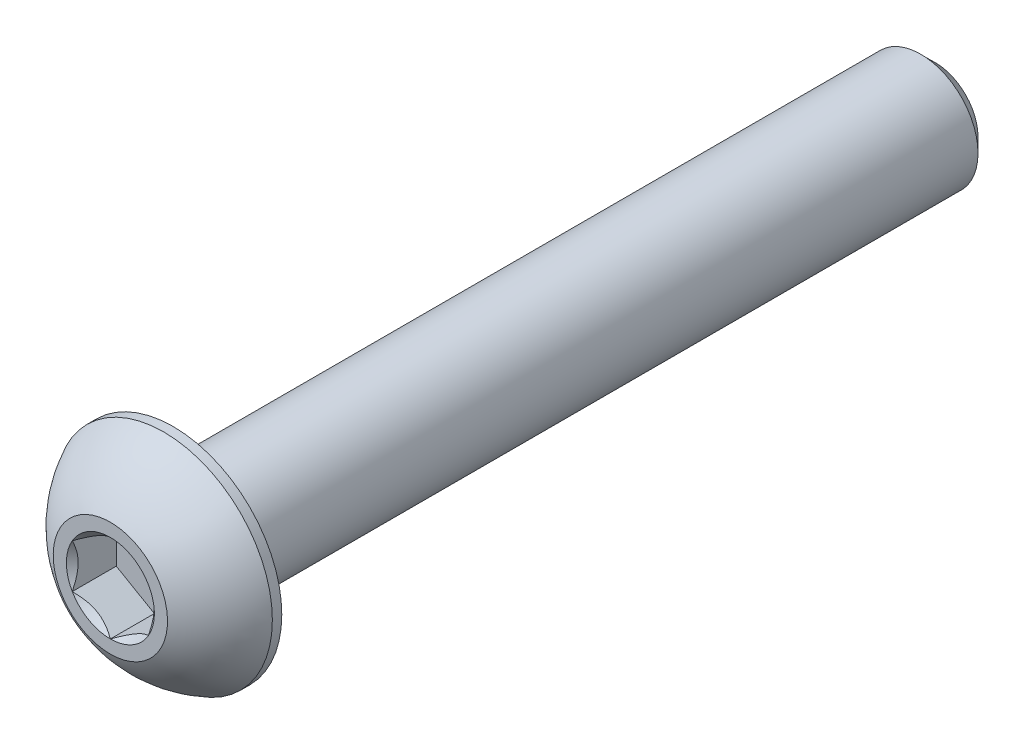
from build123d import *

# Parameters (mm, degrees)
SKETCH1_W          = 20
SKETCH1_H          = 1.5
CHAMFER1_SIZE      = 0.375
CUT_EXTRUDE2_DEPTH = 1.155


with BuildPart() as part:
    # Sketch1 → Revolve1 (revolve)
    with BuildSketch(Plane(origin=(0, 0, 0), x_dir=(0, 0, -1), z_dir=(1, 0, 0))):
        with Locations((11.65, 0.75)):
            Rectangle(SKETCH1_W, SKETCH1_H)
    revolve(axis=Axis((0, 0, -21.65), (0, 0, 1)))

    # Chamfer1
    chamfer1_edges = [part.edges().sort_by_distance(p)[0] for p in [
        (0, -1.5, -21.65),
    ]]
    chamfer(chamfer1_edges, length=CHAMFER1_SIZE)

    # Sketch7 → Revolve2 (revolve)
    with BuildSketch(Plane(origin=(0, 0, 0), x_dir=(0, 0, -1), z_dir=(1, 0, 0))):
        with BuildLine():
            Line((1.4025, 2.85), (1.65, 2.85))
            Line((1.65, 2.85), (1.65, 0))
            Line((1.65, 0), (0, 0))
            Line((0, 0), (0, 1.5))
            ThreePointArc((0, 1.5), (0.59512511, 2.285251969), (1.4025, 2.85))
        make_face()
    revolve(axis=Axis((0, 0, 0), (0, 0, -1)))

    # Sketch5 → Cut-Extrude2 (cut)
    with BuildSketch(Plane.XY):
        Polygon((1, -0.577350269), (1, 0.577350269), (0, 1.154700538), (-1, 0.577350269), (-1, -0.577350269), (0, -1.154700538), align=None)
    extrude(amount=-CUT_EXTRUDE2_DEPTH, mode=Mode.SUBTRACT)

    # Cut-Extrude3 cone 1 section (through the dimple's axis) → Cut-Extrude3 (revolve, cut)
    with BuildSketch(Plane(origin=(0, 0, 0), x_dir=(0, -1, 0), z_dir=(1, 0, 0))):
        Polygon((0, 0), (1.154700538, 0), (0, 1.154700538), align=None)
    revolve(axis=Axis((0, 0, 0), (0, 0, -1)), mode=Mode.SUBTRACT)


solid = part.part
